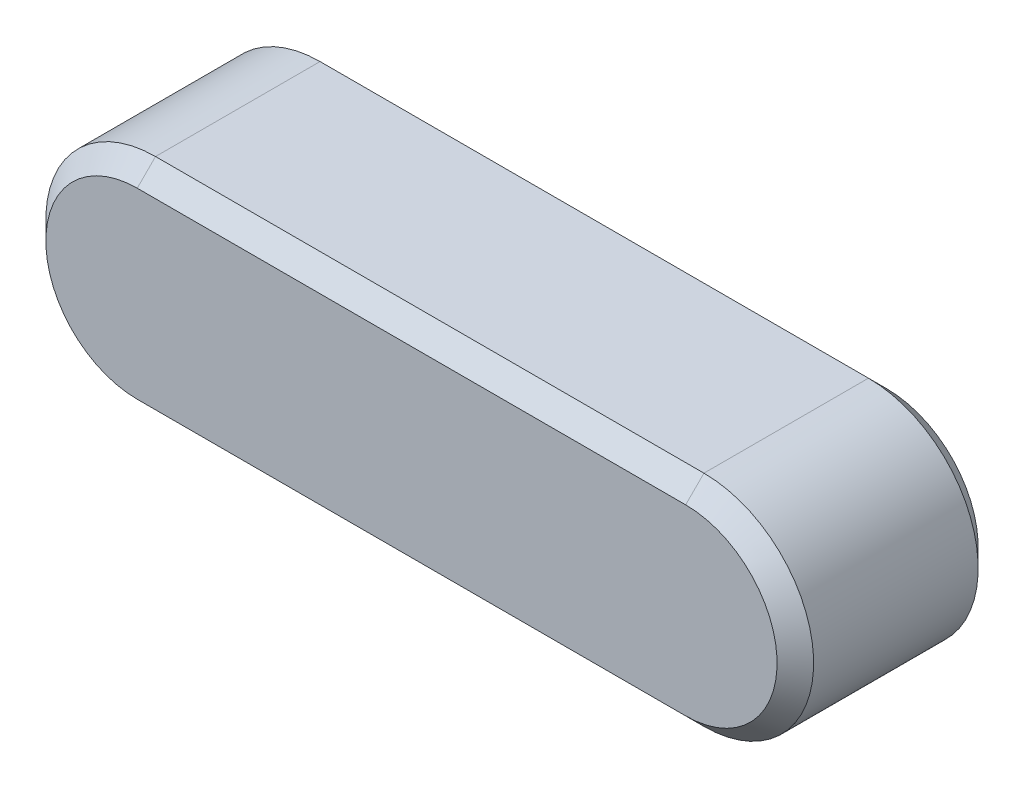
from build123d import *

# Parameters (mm, degrees)
BOSS_EXTRUDE1_DEPTH = 5.5
CHAMFER1_SIZE       = 0.5


with BuildPart() as part:
    # Sketch1 → Boss-Extrude1 (new body)
    with BuildSketch(Plane.XY):
        with BuildLine():
            Line((7.5, -3), (-7.5, -3))
            ThreePointArc((-7.5, -3), (-10.5, 0), (-7.5, 3))
            Line((-7.5, 3), (7.5, 3))
            ThreePointArc((7.5, 3), (10.5, 0), (7.5, -3))
        make_face()
    extrude(amount=BOSS_EXTRUDE1_DEPTH)

    # Chamfer1
    chamfer1_edges = [part.edges().sort_by_distance(p)[0] for p in [
        (-10.5, 0, 5.5),
        (0, -3, 5.5),
        (10.5, 0, 5.5),
        (0, -3, 0),
        (-10.5, 0, 0),
        (0, 3, 0),
        (10.5, 0, 0),
        (0, 3, 5.5),
    ]]
    chamfer(chamfer1_edges, length=CHAMFER1_SIZE)


solid = part.part
